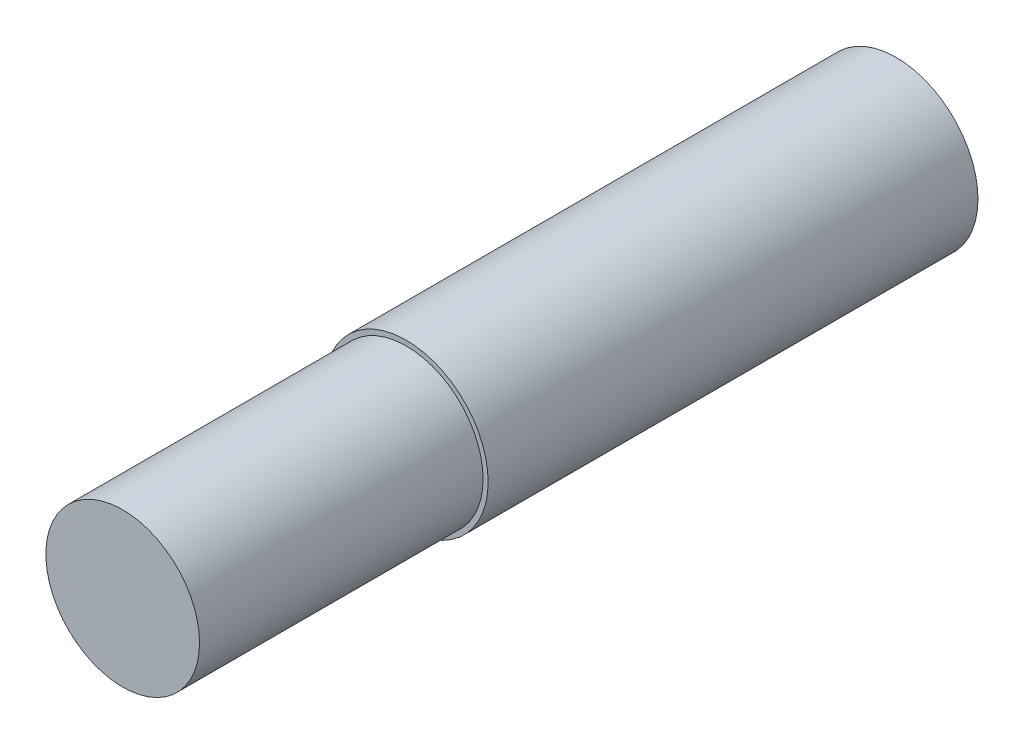
from build123d import *

# Parameters (mm, degrees)
SKETCH1_R           = 3.175
BOSS_EXTRUDE1_DEPTH = 19
SKETCH2_R           = 2.98
BOSS_EXTRUDE2_DEPTH = 11


with BuildPart() as part:
    # Sketch1 → Boss-Extrude1 (new body)
    with BuildSketch(Plane.XY):
        Circle(SKETCH1_R)
    extrude(amount=BOSS_EXTRUDE1_DEPTH)

    # Sketch2 → Boss-Extrude2 (add)
    with BuildSketch(Plane.XY.offset(19)):
        Circle(SKETCH2_R)
    extrude(amount=BOSS_EXTRUDE2_DEPTH)


solid = part.part
